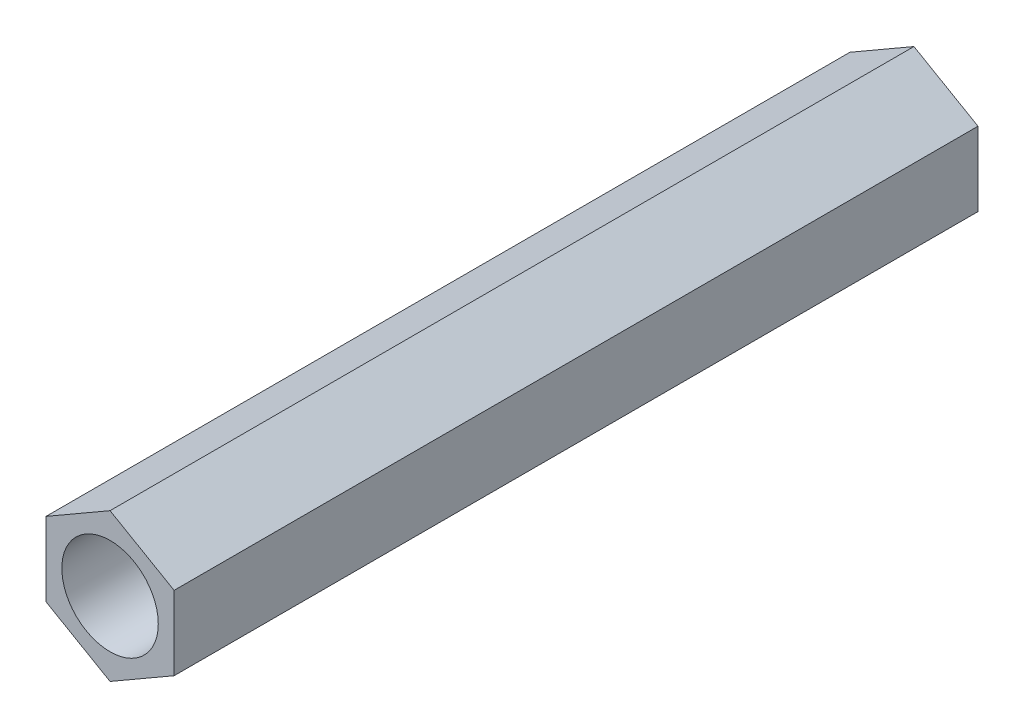
from build123d import *

# Parameters (mm, degrees)
SKETCH_1_R      = 1.5
EXTRUDE_1_DEPTH = 25


with BuildPart() as part:
    # 草图1 → 凸台-拉伸1 (new body)
    with BuildSketch(Plane.XY):
        Polygon((0, 2.3), (-1.991858429, 1.15), (-1.991858429, -1.15), (0, -2.3), (1.991858429, -1.15), (1.991858429, 1.15), align=None)
        Circle(SKETCH_1_R, mode=Mode.SUBTRACT)
    extrude(amount=EXTRUDE_1_DEPTH)


solid = part.part
